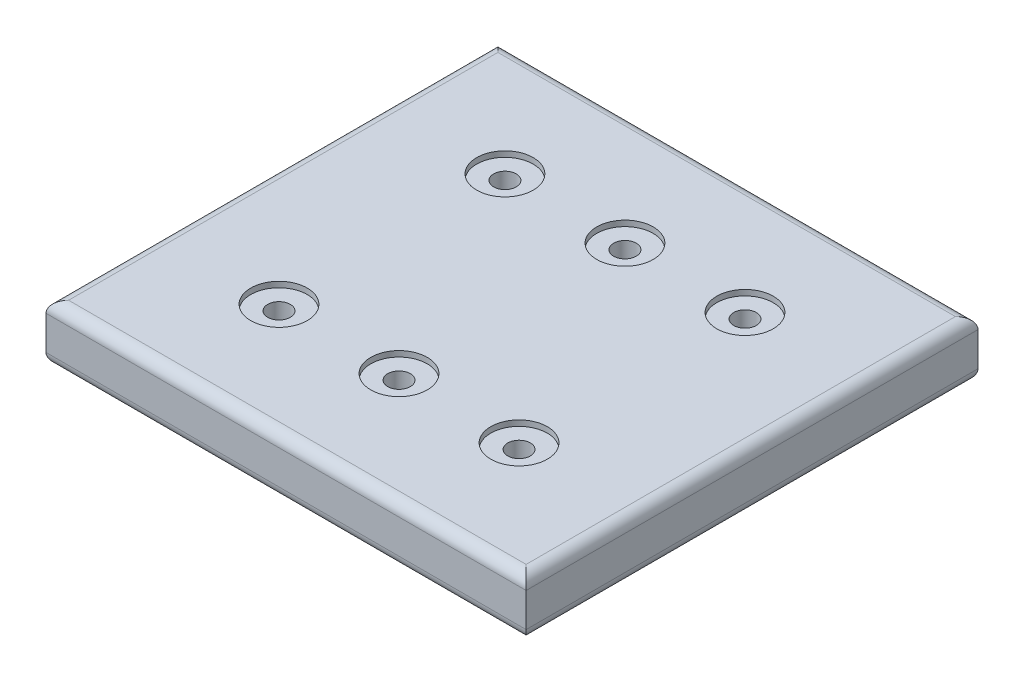
from build123d import *

# Parameters (mm, degrees)
SKETCH_1_W          = 85
SKETCH_1_H          = 80
EXTRUDE_1_DEPTH     = 10
SKETCH_2_R          = 5
SKETCH_2_R_2        = 2
CUT_EXTRUDE_1_DEPTH = 1
SKETCH_2_2_R        = 2
CUT_EXTRUDE_2_DEPTH = 78.419437026
SKETCH_3_R          = 15
CUT_EXTRUDE_3_DEPTH = 5
FILLET_1_R          = 0.5
FILLET_2_R          = 2
FILLET_3_R          = 2


with BuildPart() as part:
    # 草图1 → 凸台-拉伸1 (new body)
    with BuildSketch(Plane(origin=(0, 0, 0), x_dir=(1, 0, 0), z_dir=(0, 1, 0))):
        with Locations((-2.744934646, 22.021489166)):
            Rectangle(SKETCH_1_W, SKETCH_1_H)
    extrude(amount=EXTRUDE_1_DEPTH)

    # 草图2 → 切除-拉伸1 (cut)
    # profile 1 of 6: a face of its own
    with BuildSketch(Plane(origin=(0, 10, 0), x_dir=(1, 0, 0), z_dir=(0, 1, 0))):
        with Locations(Location((-2.744934646, 42.021489166, 0), (0, 0, 270))):
            Circle(SKETCH_2_R)
        with Locations(Location((-2.744934646, 42.021489166, 0), (0, 0, 270))):
            Circle(SKETCH_2_R_2, mode=Mode.SUBTRACT)
    # profile 2 of 6: a face of its own
    with BuildSketch(Plane(origin=(0, 10, 0), x_dir=(1, 0, 0), z_dir=(0, 1, 0))):
        with Locations(Location((-2.744934646, 2.021489166, 0), (0, 0, 270))):
            Circle(SKETCH_2_R)
        with Locations(Location((-2.744934646, 2.021489166, 0), (0, 0, 270))):
            Circle(SKETCH_2_R_2, mode=Mode.SUBTRACT)
    # profile 3 of 6: a face of its own
    with BuildSketch(Plane(origin=(0, 10, 0), x_dir=(1, 0, 0), z_dir=(0, 1, 0))):
        with Locations(Location((-23.994934646, 2.021489166, 0), (0, 0, 270))):
            Circle(SKETCH_2_R)
        with Locations(Location((-23.994934646, 2.021489166, 0), (0, 0, 270))):
            Circle(SKETCH_2_R_2, mode=Mode.SUBTRACT)
    # profile 4 of 6: a face of its own
    with BuildSketch(Plane(origin=(0, 10, 0), x_dir=(1, 0, 0), z_dir=(0, 1, 0))):
        with Locations(Location((18.505065354, 2.021489166, 0), (0, 0, 270))):
            Circle(SKETCH_2_R)
        with Locations(Location((18.505065354, 2.021489166, 0), (0, 0, 270))):
            Circle(SKETCH_2_R_2, mode=Mode.SUBTRACT)
    # profile 5 of 6: a face of its own
    with BuildSketch(Plane(origin=(0, 10, 0), x_dir=(1, 0, 0), z_dir=(0, 1, 0))):
        with Locations(Location((18.505065354, 42.021489166, 0), (0, 0, 270))):
            Circle(SKETCH_2_R)
        with Locations(Location((18.505065354, 42.021489166, 0), (0, 0, 270))):
            Circle(SKETCH_2_R_2, mode=Mode.SUBTRACT)
    # profile 6 of 6: a face of its own
    with BuildSketch(Plane(origin=(0, 10, 0), x_dir=(1, 0, 0), z_dir=(0, 1, 0))):
        with Locations(Location((-23.994934646, 42.021489166, 0), (0, 0, 270))):
            Circle(SKETCH_2_R)
        with Locations(Location((-23.994934646, 42.021489166, 0), (0, 0, 270))):
            Circle(SKETCH_2_R_2, mode=Mode.SUBTRACT)
    extrude(amount=-CUT_EXTRUDE_1_DEPTH, mode=Mode.SUBTRACT)

    # 草图2<2> → 切除-拉伸2 (cut, through all)
    with BuildSketch(Plane(origin=(0, 10, 0), x_dir=(1, 0, 0), z_dir=(0, 1, 0))):
        with Locations(Location((18.505065354, 42.021489166, 0), (0, 0, 270))):
            Circle(SKETCH_2_2_R)
        with Locations(Location((-2.744934646, 42.021489166, 0), (0, 0, 270))):
            Circle(SKETCH_2_2_R)
        with Locations(Location((-23.994934646, 42.021489166, 0), (0, 0, 270))):
            Circle(SKETCH_2_2_R)
        with Locations(Location((-23.994934646, 2.021489166, 0), (0, 0, 270))):
            Circle(SKETCH_2_2_R)
        with Locations(Location((-2.744934646, 2.021489166, 0), (0, 0, 270))):
            Circle(SKETCH_2_2_R)
        with Locations(Location((18.505065354, 2.021489166, 0), (0, 0, 270))):
            Circle(SKETCH_2_2_R)
    extrude(amount=-CUT_EXTRUDE_2_DEPTH, mode=Mode.SUBTRACT)

    # 草图3 → 切除-拉伸3 (cut)
    with BuildSketch(Plane(origin=(0, 0, 0), x_dir=(-1, 0, 0), z_dir=(0, -1, 0))):
        with Locations(Location((2.744934646, 22.021489166, 0), (0, 0, 90))):
            Circle(SKETCH_3_R)
    extrude(amount=-CUT_EXTRUDE_3_DEPTH, mode=Mode.SUBTRACT)

    # 圆角1
    fillet_1_edges = [part.edges().sort_by_distance(p)[0] for p in [
        (-2.744934646, 0, -7.021489166),
    ]]
    fillet(fillet_1_edges, radius=FILLET_1_R)

    # 圆角2
    fillet_2_edges = [part.edges().sort_by_distance(p)[0] for p in [
        (-2.744934646, 0, -62.021489166),
        (39.755065354, 0, -22.021489166),
        (-2.744934646, 0, 17.978510834),
        (-45.244934646, 0, -22.021489166),
    ]]
    fillet(fillet_2_edges, radius=FILLET_2_R)

    # 圆角3
    fillet_3_edges = [part.edges().sort_by_distance(p)[0] for p in [
        (39.755065354, 10, -22.021489166),
        (-2.744934646, 10, -62.021489166),
        (-45.244934646, 10, -22.021489166),
        (-2.744934646, 10, 17.978510834),
    ]]
    fillet(fillet_3_edges, radius=FILLET_3_R)


solid = part.part
